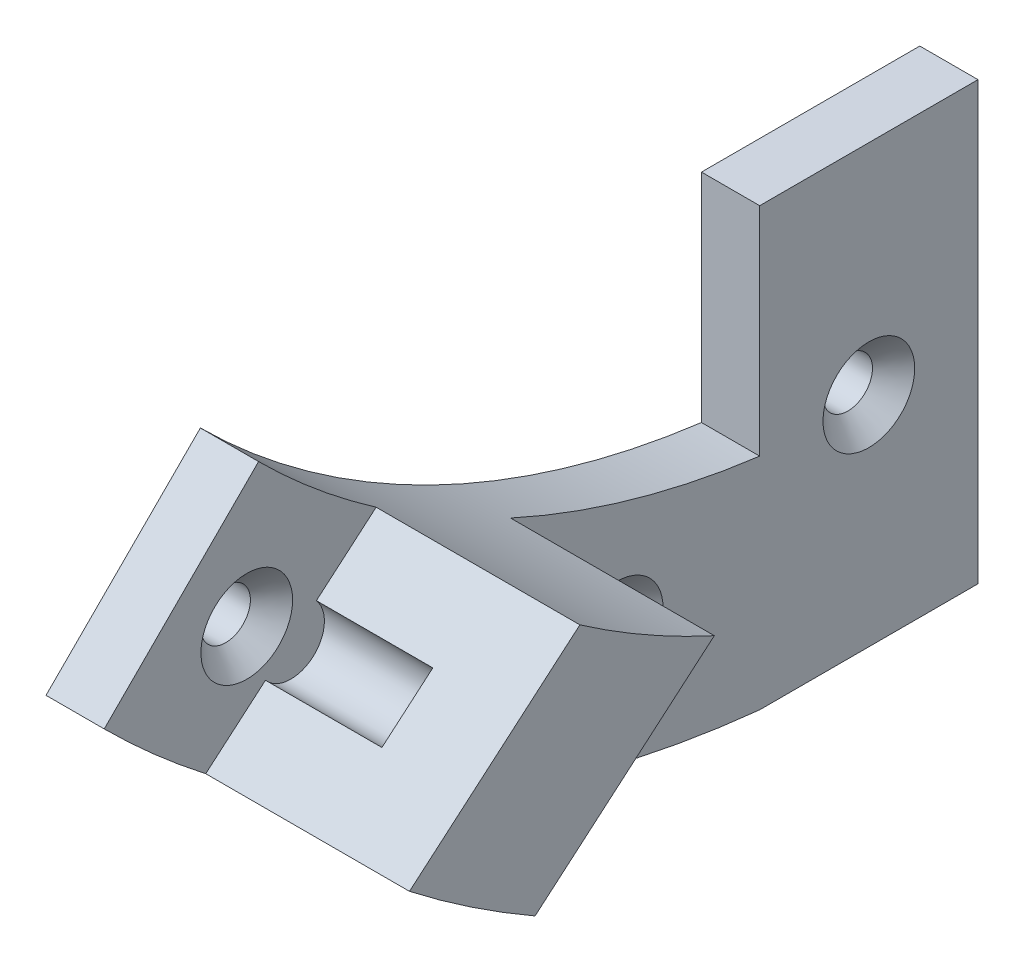
from build123d import *

# Parameters (mm, degrees)
SKETCH1_W                                       = 15
SKETCH1_H                                       = 30
BOSS_EXTRUDE1_DEPTH                             = 4
BOSS_EXTRUDE2_DEPTH                             = 14
SKETCH3_R                                       = 2.3
CUT_EXTRUDE1_DEPTH                              = 8
CSK_FOR_M3_FLAT_HEAD_MACHINE_SCREW1_D           = 3.4
CSK_FOR_M3_FLAT_HEAD_MACHINE_SCREW1_DEPTH       = 6.35
CSK_FOR_M3_FLAT_HEAD_MACHINE_SCREW1_CSINK_D     = 6.3
CSK_FOR_M3_FLAT_HEAD_MACHINE_SCREW1_CSINK_ANGLE = 90
CSK_FOR_M3_FLAT_HEAD_MACHINE_SCREW1_TIP         = 1.021463052


with BuildPart() as part:
    # Sketch1 → Boss-Extrude1 (new body)
    with BuildSketch(Plane(origin=(0, 0, 0), x_dir=(0, 0, -1), z_dir=(1, 0, 0))):
        with BuildLine():
            Line((-33.857008974, 10.235870452), (-45.565370995, 0.232449935))
            ThreePointArc((-45.565370995, 0.232449935), (-27.604171468, -10.061381798), (-7.5, -15))
            Line((-7.5, -15), (-7.5, 0.096693129))
            ThreePointArc((-7.5, 0.096693129), (-21.290873092, 3.574416464), (-33.857008974, 10.235870452))
        make_face()
        Rectangle(SKETCH1_W, SKETCH1_H)
        with BuildLine():
            Line((-41.931432124, 16.989065709), (-52.538033842, 6.382463992))
            ThreePointArc((-52.538033842, 6.382463992), (-49.147992618, 3.198286628), (-45.565370995, 0.232449935))
            Line((-45.565370995, 0.232449935), (-33.857008974, 10.235870452))
            ThreePointArc((-33.857008974, 10.235870452), (-38.044360457, 13.432954073), (-41.931432124, 16.989065709))
        make_face()
    extrude(amount=BOSS_EXTRUDE1_DEPTH)

    # Sketch2 → Boss-Extrude2 (add)
    with BuildSketch(Plane(origin=(4, 0, 0), x_dir=(0, 0, -1), z_dir=(1, 0, 0))):
        with BuildLine():
            Line((-33.854727787, 10.234284113), (-45.563203072, 0.230766826))
            ThreePointArc((-45.563203072, 0.230766826), (-41.349722145, -2.810292527), (-36.933994133, -5.549418231))
            Line((-36.933994133, -5.549418231), (-24.61890521, 4.97237918))
            ThreePointArc((-24.61890521, 4.97237918), (-29.354954434, 7.395973089), (-33.854727787, 10.234284113))
        make_face()
    extrude(amount=BOSS_EXTRUDE2_DEPTH)

    # Sketch3 → Cut-Extrude1 (cut)
    with BuildSketch(Plane(origin=(4, 0, 0), x_dir=(0, 0, -1), z_dir=(1, 0, 0))):
        with Locations((-39.70896543, 5.232525469)):
            Circle(SKETCH3_R)
    extrude(amount=CUT_EXTRUDE1_DEPTH, mode=Mode.SUBTRACT)

    # CSK for M3 Flat Head Machine Screw1
    with Locations(Plane(origin=(4, 0, 0), x_dir=(0, 0, -1), z_dir=(1, 0, 0))):
        with Locations((-42.74343682, 7.59), (-17.289112213, -5.603347362), (0, 0)):
            CounterSinkHole(CSK_FOR_M3_FLAT_HEAD_MACHINE_SCREW1_D / 2, CSK_FOR_M3_FLAT_HEAD_MACHINE_SCREW1_CSINK_D / 2, depth=CSK_FOR_M3_FLAT_HEAD_MACHINE_SCREW1_DEPTH, counter_sink_angle=CSK_FOR_M3_FLAT_HEAD_MACHINE_SCREW1_CSINK_ANGLE)
            with Locations((0, 0, -(CSK_FOR_M3_FLAT_HEAD_MACHINE_SCREW1_DEPTH + CSK_FOR_M3_FLAT_HEAD_MACHINE_SCREW1_TIP / 2))):  # 118° drill point
                Cone(0, CSK_FOR_M3_FLAT_HEAD_MACHINE_SCREW1_D / 2, CSK_FOR_M3_FLAT_HEAD_MACHINE_SCREW1_TIP, mode=Mode.SUBTRACT)


solid = part.part
